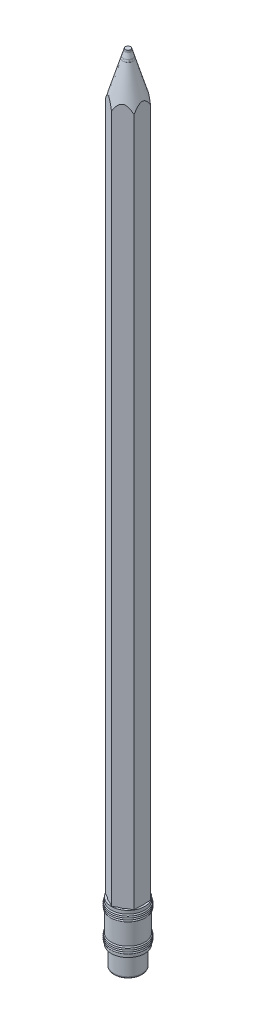
from build123d import *

# Parameters (mm, degrees)
SKETCH4_R           = 1.275
BOSS_EXTRUDE2_DEPTH = 185
BOSS_EXTRUDE3_DEPTH = 185
SKETCH11_R          = 3.5
BOSS_EXTRUDE4_DEPTH = 10
FILLET1_R           = 0.5


with BuildPart() as part:
    # Sketch4 → Boss-Extrude2 (new body)
    with BuildSketch(Plane(origin=(0, 0, 0), x_dir=(1, 0, 0), z_dir=(0, 1, 0))):
        with Locations(Location((0, 0, 0), (0, 0, 270))):
            Circle(SKETCH4_R)
    extrude(amount=BOSS_EXTRUDE2_DEPTH)


with BuildPart() as body_2:
    # Sketch5 → Boss-Extrude3 (new body)
    with BuildSketch(Plane(origin=(0, 185, 0), x_dir=(1, 0, 0), z_dir=(0, 1, 0))):
        Polygon((0, 4.041451884), (-3.5, 2.020725942), (-3.5, -2.020725942), (0, -4.041451884), (3.5, -2.020725942), (3.5, 2.020725942), align=None)
    extrude(amount=-BOSS_EXTRUDE3_DEPTH)


with BuildPart() as body_3:
    # Sketch11 → Boss-Extrude4 (new body)
    with BuildSketch(Plane.XZ):
        with Locations(Location((0, 0, 0), (0, 0, 270))):
            Circle(SKETCH11_R)
    extrude(amount=BOSS_EXTRUDE4_DEPTH)

    # Fillet1
    fillet1_edges = [body_3.edges().sort_by_distance(p)[0] for p in [
        (0, -10, 3.5),
    ]]
    fillet(fillet1_edges, radius=FILLET1_R)


with BuildPart() as body_4:
    # Sketch15 → Revolve1 (revolve)
    with BuildSketch(Plane.XY, mode=Mode.PRIVATE) as revolve1_sk:
        with BuildLine():
            Line((-4.1, -5), (-4.1, -4.2))
            ThreePointArc((-4.1, -4.2), (-4.3, -4), (-4.1, -3.8))
            ThreePointArc((-4.1, -3.8), (-4.3, -3.6), (-4.1, -3.4))
            ThreePointArc((-4.1, -3.4), (-4.3, -3.2), (-4.1, -3))
            ThreePointArc((-4.1, -3), (-4.3, -2.8), (-4.1, -2.6))
            Line((-4.1, -2.6), (-4.1, 2.6))
            ThreePointArc((-4.1, 2.6), (-4.3, 2.8), (-4.1, 3))
            ThreePointArc((-4.1, 3), (-4.3, 3.2), (-4.1, 3.4))
            ThreePointArc((-4.1, 3.4), (-4.3, 3.6), (-4.1, 3.8))
            ThreePointArc((-4.1, 3.8), (-4.3, 4), (-4.1, 4.2))
            Line((-4.1, 4.2), (-4.1, 5))
            Line((-4.1, 5), (-3.6, 5))
            Line((-3.6, 5), (-3.6, -5))
            Line((-3.6, -5), (-4.1, -5))
        make_face()
    revolve(revolve1_sk.sketch.rotate(Axis((0, -9.916969994, 0), (0, 1, 0)), 270), axis=Axis((0, -9.916969994, 0), (0, 1, 0)))


with BuildPart() as cut_revolve1_tool:
    # Sketch17 → Cut-Revolve1 (revolve)
    with BuildSketch(Plane.XY):
        Polygon((-0.5, 185.463421796), (-5, 185.463421796), (-5, 170.463421796), align=None)
    revolve(axis=Axis((0, 0, 0), (0, 1, 0)))


with BuildPart() as part_1:
    add(part.part)

    # Cut-Revolve1: cut by cut_revolve1_tool
    add(cut_revolve1_tool.part, mode=Mode.SUBTRACT)


with BuildPart() as body_2_1:
    add(body_2.part)

    # Cut-Revolve1: cut by cut_revolve1_tool
    add(cut_revolve1_tool.part, mode=Mode.SUBTRACT)


solid = Compound([body_3.part, body_4.part, part_1.part, body_2_1.part])
